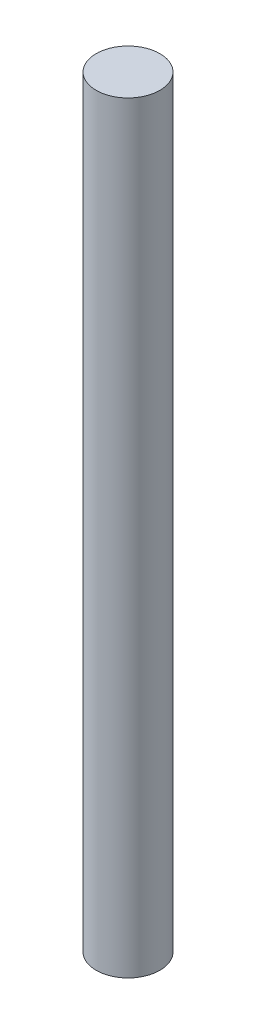
from build123d import *

# Parameters (mm, degrees)
CROQUIS1_R              = 4.7625
SALIENTE_EXTRUIR1_DEPTH = 114


with BuildPart() as part:
    # Croquis1 → Saliente-Extruir1 (new body)
    with BuildSketch(Plane(origin=(0, 0, 0), x_dir=(1, 0, 0), z_dir=(0, 1, 0))):
        with Locations(Location((0, 0, 0), (0, 0, 90))):
            Circle(CROQUIS1_R)
    extrude(amount=SALIENTE_EXTRUIR1_DEPTH)


solid = part.part
